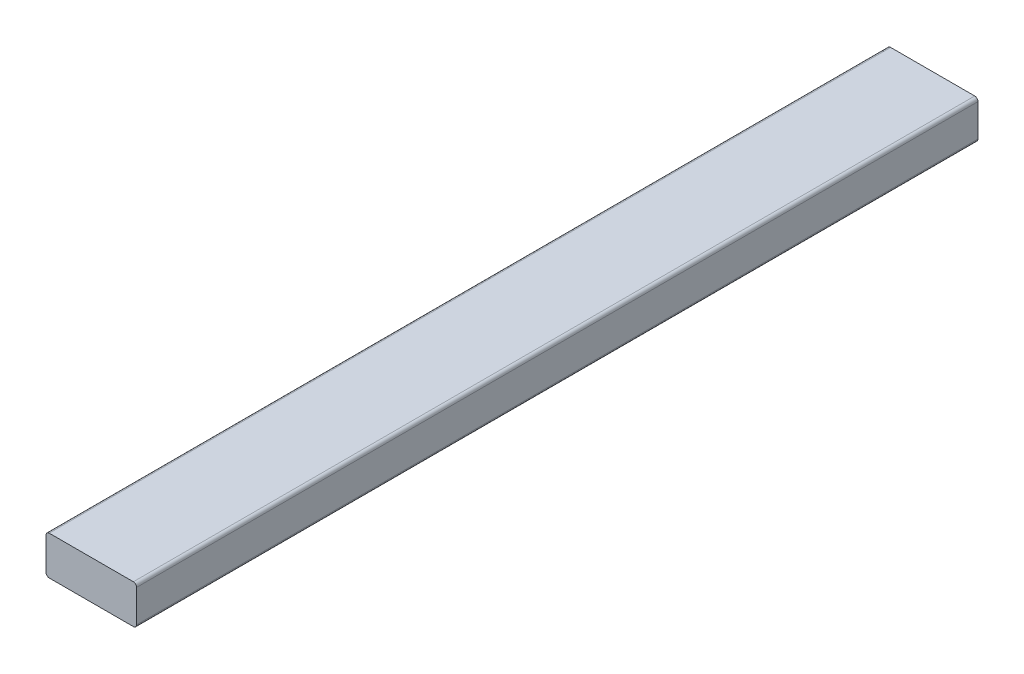
from build123d import *

# Parameters (mm, degrees)
SKETCH1_W           = 88.9
SKETCH1_H           = 38.1
BOSS_EXTRUDE1_DEPTH = 412.75
FILLET1_R           = 3.175


with BuildPart() as part:
    # Sketch1 → Boss-Extrude1 (new, symmetric)
    with BuildSketch(Plane.XY):
        Rectangle(SKETCH1_W, SKETCH1_H)
    extrude(amount=BOSS_EXTRUDE1_DEPTH, both=True)

    # Fillet1
    fillet1_edges = [part.edges().sort_by_distance(p)[0] for p in [
        (44.45, -19.05, 0),
        (-44.45, -19.05, 0),
        (-44.45, 19.05, 0),
        (44.45, 19.05, 0),
    ]]
    fillet(fillet1_edges, radius=FILLET1_R)


solid = part.part
